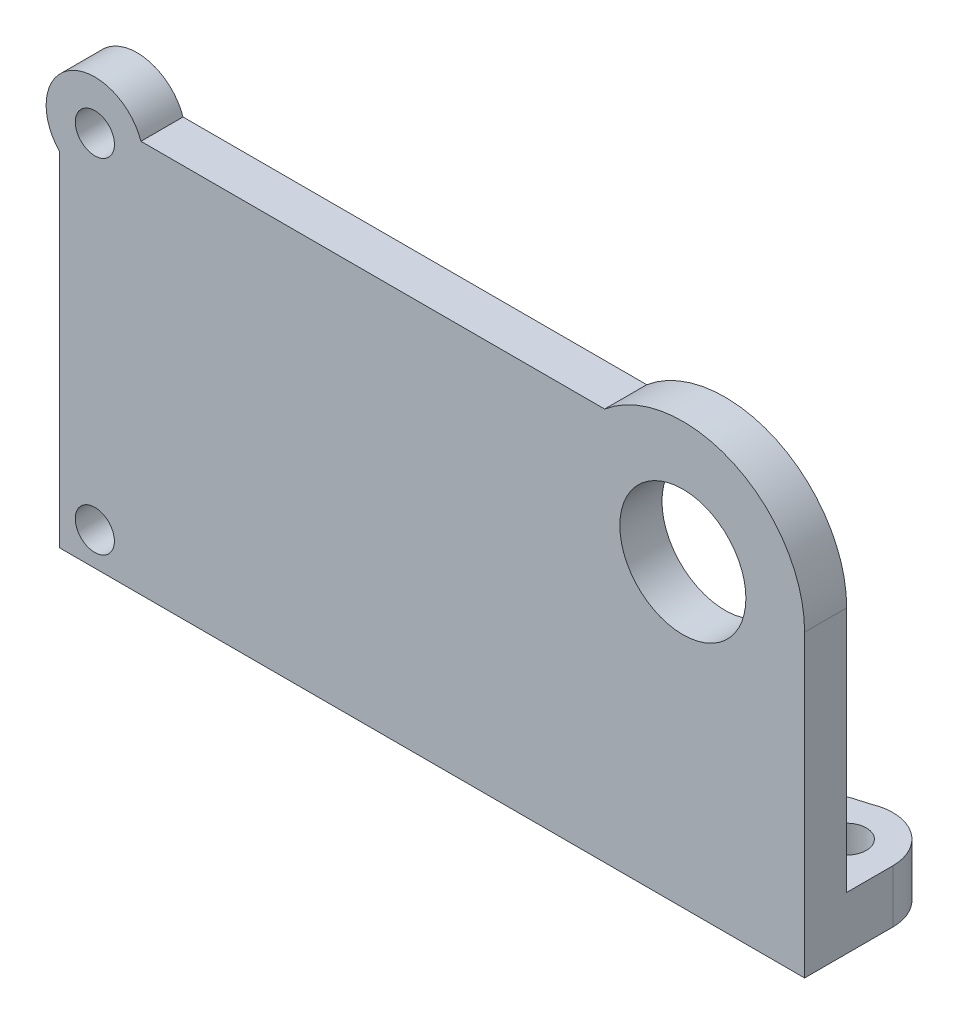
from build123d import *

# Parameters (mm, degrees)
SKETCH1_W            = 6.266
SKETCH1_H            = 19.6
SKETCH1_R            = 1.675
SKETCH1_W_2          = 52.832
SKETCH1_H_2          = 5
BOSS_EXTRUDE2_DEPTH  = 3.175
SKETCH3_W            = 30
SKETCH3_H            = 29.6
BOSS_EXTRUDE3_DEPTH  = 3.175
SKETCH4_R            = 4.75
CUT_EXTRUDE1_DEPTH   = 10
BOSS_EXTRUDE14_DEPTH = 3.175
CUT_EXTRUDE8_DEPTH   = 10
SKETCH24_R           = 1.675
CUT_EXTRUDE9_DEPTH   = 10
SKETCH25_R           = 3.675
SKETCH25_R_2         = 1.675
BOSS_EXTRUDE15_DEPTH = 3.175
SKETCH27_W           = 52.932563224
SKETCH27_H           = 23.005559857
BOSS_EXTRUDE16_DEPTH = 3.175
CUT_EXTRUDE14_DEPTH  = 10
SKETCH29_R           = 1.675
CUT_EXTRUDE15_DEPTH  = 10
SKETCH30_R           = 1.475
CUT_EXTRUDE16_DEPTH  = 10
SKETCH31_R           = 3.675
SKETCH31_R_2         = 1.675
BOSS_EXTRUDE17_DEPTH = 3.175
SKETCH33_R           = 1.475
CUT_EXTRUDE17_DEPTH  = 53.757206626
SKETCH37_R           = 3.475
SKETCH37_R_2         = 1.475
BOSS_EXTRUDE21_DEPTH = 4
BOSS_EXTRUDE22_DEPTH = 4
SKETCH39_R           = 1.675
SKETCH39_R_2         = 1.475
BOSS_EXTRUDE23_DEPTH = 3.175


with BuildPart() as part:
    # Sketch1 → Boss-Extrude2 (new body)
    # profile 1 of 4: a face of its own
    with BuildSketch(Plane.XY):
        with Locations((-23.283, 0)):
            Rectangle(SKETCH1_W, SKETCH1_H)
        with Locations((-23.95, -4.974)):
            Circle(SKETCH1_R, mode=Mode.SUBTRACT)
        with Locations((-23.95, 4.974)):
            Circle(SKETCH1_R, mode=Mode.SUBTRACT)
    # profile 2 of 4: a face of its own
    with BuildSketch(Plane.XY):
        with Locations((0, -12.3)):
            Rectangle(SKETCH1_W_2, SKETCH1_H_2)
    # profile 3 of 4: a face of its own
    with BuildSketch(Plane.XY):
        with Locations((0, 12.3)):
            Rectangle(SKETCH1_W_2, SKETCH1_H_2)
    # profile 4 of 4: a face of its own
    with BuildSketch(Plane.XY):
        with Locations((23.283, 0)):
            Rectangle(SKETCH1_W, SKETCH1_H)
        with Locations((23.95, -4.974)):
            Circle(SKETCH1_R, mode=Mode.SUBTRACT)
        with Locations((23.95, 4.974)):
            Circle(SKETCH1_R, mode=Mode.SUBTRACT)
    extrude(amount=BOSS_EXTRUDE2_DEPTH)

    # Sketch3 → Boss-Extrude3 (add)
    with BuildSketch(Plane.XY.offset(3.175)):
        with Locations((41.416, 0)):
            Rectangle(SKETCH3_W, SKETCH3_H)
    extrude(amount=-BOSS_EXTRUDE3_DEPTH)

    # Sketch4 → Cut-Extrude1 (cut)
    with BuildSketch(Plane(origin=(0, 0, 0), x_dir=(-1, 0, 0), z_dir=(0, 0, -1))):
        with Locations((-40.576, 7.77)):
            Circle(SKETCH4_R)
    extrude(amount=-CUT_EXTRUDE1_DEPTH, mode=Mode.SUBTRACT)

    # Sketch22 → Boss-Extrude14 (add)
    with BuildSketch(Plane(origin=(0, 0, 0), x_dir=(-1, 0, 0), z_dir=(0, 0, -1))):
        with BuildLine():
            ThreePointArc((-34.680262133, 14.8), (-40.576, 16.945), (-46.471737867, 14.8))
            Line((-46.471737867, 14.8), (-34.680262133, 14.8))
        make_face()
    extrude(amount=-BOSS_EXTRUDE14_DEPTH)

    # Sketch23 → Cut-Extrude8 (cut)
    with BuildSketch(Plane(origin=(0, 0, 0), x_dir=(-1, 0, 0), z_dir=(0, 0, -1))):
        with BuildLine():
            Line((-49.751, -14.8), (-49.751, 7.77))
            ThreePointArc((-49.751, 7.77), (-48.890866804, 11.648609936), (-46.471737867, 14.8))
            Line((-46.471737867, 14.8), (-56.416, 14.8))
            Line((-56.416, 14.8), (-56.416, -14.8))
            Line((-56.416, -14.8), (-49.751, -14.8))
        make_face()
    extrude(amount=-CUT_EXTRUDE8_DEPTH, mode=Mode.SUBTRACT)

    # Sketch24 → Cut-Extrude9 (cut)
    with BuildSketch(Plane(origin=(0, 0, 0), x_dir=(-1, 0, 0), z_dir=(0, 0, -1))):
        with Locations((23.736, 13.59)):
            Circle(SKETCH24_R)
    extrude(amount=-CUT_EXTRUDE9_DEPTH, mode=Mode.SUBTRACT)

    # Sketch25 → Boss-Extrude15 (add)
    # profile 1 of 3: a face of its own
    with BuildSketch(Plane(origin=(0, 0, 0), x_dir=(-1, 0, 0), z_dir=(0, 0, -1))):
        with Locations((23.95, -4.974)):
            Circle(SKETCH25_R)
        with Locations(Location((23.95, -4.974, 0), (0, 0, 180))):
            Circle(SKETCH25_R_2, mode=Mode.SUBTRACT)
    # profile 2 of 3: a face of its own
    with BuildSketch(Plane(origin=(0, 0, 0), x_dir=(-1, 0, 0), z_dir=(0, 0, -1))):
        with Locations((23.95, 4.974)):
            Circle(SKETCH25_R)
        with Locations(Location((23.95, 4.974, 0), (0, 0, 180))):
            Circle(SKETCH25_R_2, mode=Mode.SUBTRACT)
    # profile 3 of 3: a face of its own
    with BuildSketch(Plane(origin=(0, 0, 0), x_dir=(-1, 0, 0), z_dir=(0, 0, -1))):
        with Locations((23.736, 13.59)):
            Circle(SKETCH25_R)
        with Locations((23.736, 13.59)):
            Circle(SKETCH25_R_2, mode=Mode.SUBTRACT)
    extrude(amount=-BOSS_EXTRUDE15_DEPTH)

    # Sketch27 → Boss-Extrude16 (add)
    with BuildSketch(Plane(origin=(0, 0, 0), x_dir=(-1, 0, 0), z_dir=(0, 0, -1))):
        with Locations((-0.417160697, -0.481381251)):
            Rectangle(SKETCH27_W, SKETCH27_H)
    extrude(amount=-BOSS_EXTRUDE16_DEPTH)

    # Sketch28 → Cut-Extrude14 (cut)
    with BuildSketch(Plane(origin=(0, 0, 0), x_dir=(-1, 0, 0), z_dir=(0, 0, -1))):
        Polygon((26.416, 8.97792488), (26.416, -8.885991227), (33.695668031, -3.414754928), align=None)
    extrude(amount=-CUT_EXTRUDE14_DEPTH, mode=Mode.SUBTRACT)

    # Sketch29 → Cut-Extrude15 (cut)
    # profile 1 of 4: a face of its own
    with BuildSketch(Plane(origin=(0, 0, 0), x_dir=(-1, 0, 0), z_dir=(0, 0, -1))):
        with BuildLine():
            Line((6.416, -14.8), (26.416, -14.8))
            Line((26.416, -14.8), (26.416, 8.759294646))
            Line((26.416, 8.759294646), (26.416, 11.075397646))
            Line((26.416, 11.075397646), (26.416, 16.104602354))
            ThreePointArc((26.416, 16.104602354), (22.973400892, 17.185005925), (20.265909944, 14.8))
            Line((20.265909944, 14.8), (6.416, 14.8))
            Line((6.416, 14.8), (6.416, -14.8))
        make_face()
        with Locations((23.736, 13.59)):
            Circle(SKETCH29_R, mode=Mode.SUBTRACT)
    # profile 2 of 4: a face of its own
    with BuildSketch(Plane(origin=(0, 0, 0), x_dir=(-1, 0, 0), z_dir=(0, 0, -1))):
        with BuildLine():
            Line((26.416, 11.075397646), (26.416, 8.759294646))
            Line((26.416, 8.759294646), (29.849387413, 8.759294646))
            Line((29.849387413, 8.759294646), (29.849387413, 20.986227432))
            Line((29.849387413, 20.986227432), (26.416, 20.986227432))
            Line((26.416, 20.986227432), (26.416, 16.104602354))
            ThreePointArc((26.416, 16.104602354), (27.411, 13.59), (26.416, 11.075397646))
        make_face()
    # profile 3 of 4: a face of its own
    with BuildSketch(Plane(origin=(0, 0, 0), x_dir=(-1, 0, 0), z_dir=(0, 0, -1))):
        with BuildLine():
            Line((26.416, 16.104602354), (26.416, 11.075397646))
            ThreePointArc((26.416, 11.075397646), (27.411, 13.59), (26.416, 16.104602354))
        make_face()
    # profile 4 of 4: a face of its own
    with BuildSketch(Plane(origin=(0, 0, 0), x_dir=(-1, 0, 0), z_dir=(0, 0, -1))):
        with BuildLine():
            Line((6.416, 20.986227432), (6.416, 14.8))
            Line((6.416, 14.8), (20.265909944, 14.8))
            ThreePointArc((20.265909944, 14.8), (22.973400892, 17.185005925), (26.416, 16.104602354))
            Line((26.416, 16.104602354), (26.416, 20.986227432))
            Line((26.416, 20.986227432), (6.416, 20.986227432))
        make_face()
    extrude(amount=-CUT_EXTRUDE15_DEPTH, mode=Mode.SUBTRACT)

    # Sketch30 → Cut-Extrude16 (cut)
    with BuildSketch(Plane(origin=(0, 0, 0), x_dir=(-1, 0, 0), z_dir=(0, 0, -1))):
        with Locations((3.736, 13.59)):
            Circle(SKETCH30_R)
    extrude(amount=-CUT_EXTRUDE16_DEPTH, mode=Mode.SUBTRACT)

    # Sketch31 → Boss-Extrude17 (add)
    with BuildSketch(Plane(origin=(0, 0, 0), x_dir=(-1, 0, 0), z_dir=(0, 0, -1))):
        with Locations((3.736, 13.59)):
            Circle(SKETCH31_R)
        with Locations((3.736, 13.59)):
            Circle(SKETCH31_R_2, mode=Mode.SUBTRACT)
    extrude(amount=-BOSS_EXTRUDE17_DEPTH)

    # Sketch33 → Cut-Extrude17 (cut, through all)
    with BuildSketch(Plane(origin=(0, 0, 0), x_dir=(-1, 0, 0), z_dir=(0, 0, -1))):
        with Locations((3.741, -12.3)):
            Circle(SKETCH33_R)
    extrude(amount=-CUT_EXTRUDE17_DEPTH, mode=Mode.SUBTRACT)

    # Sketch37 → Boss-Extrude21 (add)
    # profile 1 of 3: a face of its own
    with BuildSketch(Plane(origin=(0, -14.8, 0), x_dir=(-1, 0, 0), z_dir=(0, -1, 0))):
        with BuildLine():
            ThreePointArc((-46.276, 0), (-48.733196065, 1.017803935), (-49.751, 3.475))
            Line((-49.751, 3.475), (-49.751, 0))
            Line((-49.751, 0), (-46.276, 0))
        make_face()
    # profile 2 of 3: a face of its own
    with BuildSketch(Plane(origin=(0, -14.8, 0), x_dir=(-1, 0, 0), z_dir=(0, -1, 0))):
        with Locations((-46.276, 3.475)):
            Circle(SKETCH37_R)
        with Locations(Location((-46.276, 3.475, 0), (0, 0, 180))):
            Circle(SKETCH37_R_2, mode=Mode.SUBTRACT)
    # profile 3 of 3: a face of its own
    with BuildSketch(Plane(origin=(0, -14.8, 0), x_dir=(-1, 0, 0), z_dir=(0, -1, 0))):
        with BuildLine():
            Line((-42.801, 0), (-42.801, 3.475))
            ThreePointArc((-42.801, 3.475), (-43.818803935, 1.017803935), (-46.276, 0))
            Line((-46.276, 0), (-42.801, 0))
        make_face()
    extrude(amount=-BOSS_EXTRUDE21_DEPTH)

    # Sketch38 → Boss-Extrude22 (add)
    with BuildSketch(Plane(origin=(0, -14.8, 0), x_dir=(-1, 0, 0), z_dir=(0, -1, 0))):
        with BuildLine():
            Line((-35.826, 0), (-42.801, 0))
            Line((-42.801, 0), (-42.801, 3.475))
            Line((-42.801, 3.475), (-46.276, 6.95))
            ThreePointArc((-46.276, 6.95), (-40.28432198, 4.627774865), (-35.826, 0))
        make_face()
    extrude(amount=-BOSS_EXTRUDE22_DEPTH)

    # Sketch39 → Boss-Extrude23 (add)
    with BuildSketch(Plane(origin=(0, 0, 0), x_dir=(-1, 0, 0), z_dir=(0, 0, -1))):
        with Locations((3.736, 13.59)):
            Circle(SKETCH39_R)
        with Locations((3.736, 13.59)):
            Circle(SKETCH39_R_2, mode=Mode.SUBTRACT)
    extrude(amount=-BOSS_EXTRUDE23_DEPTH)


solid = part.part
